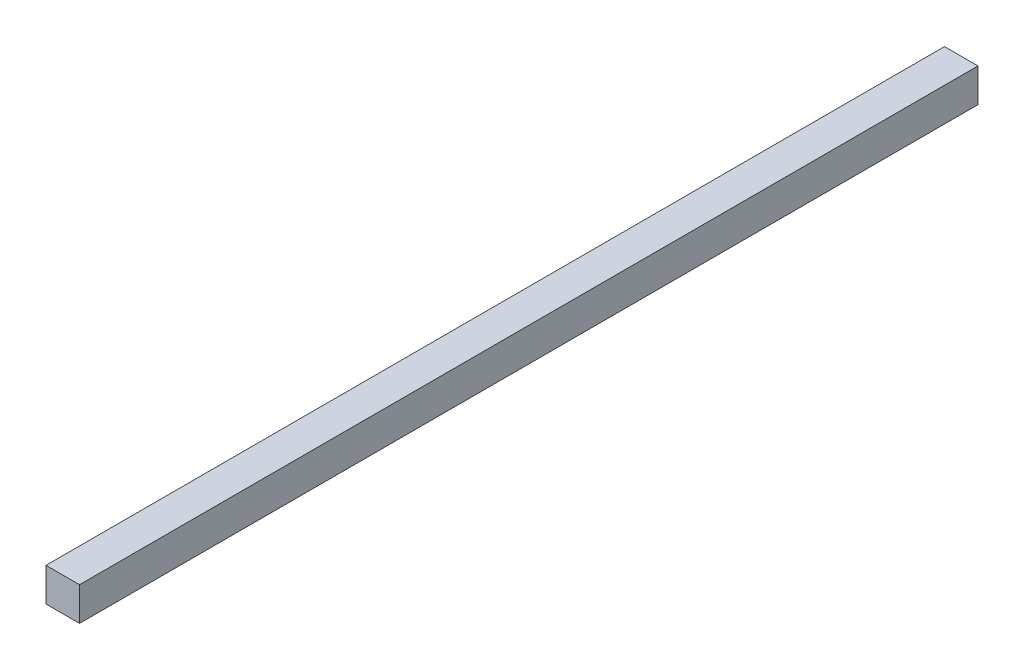
from build123d import *

# Parameters (mm, degrees)
SKETCH2_W           = 37.85108
SKETCH2_H           = 1.41224
BOSS_EXTRUDE1_DEPTH = 1.41224


with BuildPart() as part:
    # Sketch2 → Boss-Extrude1 (new body)
    with BuildSketch(Plane(origin=(0, 0, 0), x_dir=(0, 0, -1), z_dir=(1, 0, 0))):
        with Locations((18.92554, 0.70612)):
            Rectangle(SKETCH2_W, SKETCH2_H)
    extrude(amount=BOSS_EXTRUDE1_DEPTH)


solid = part.part
